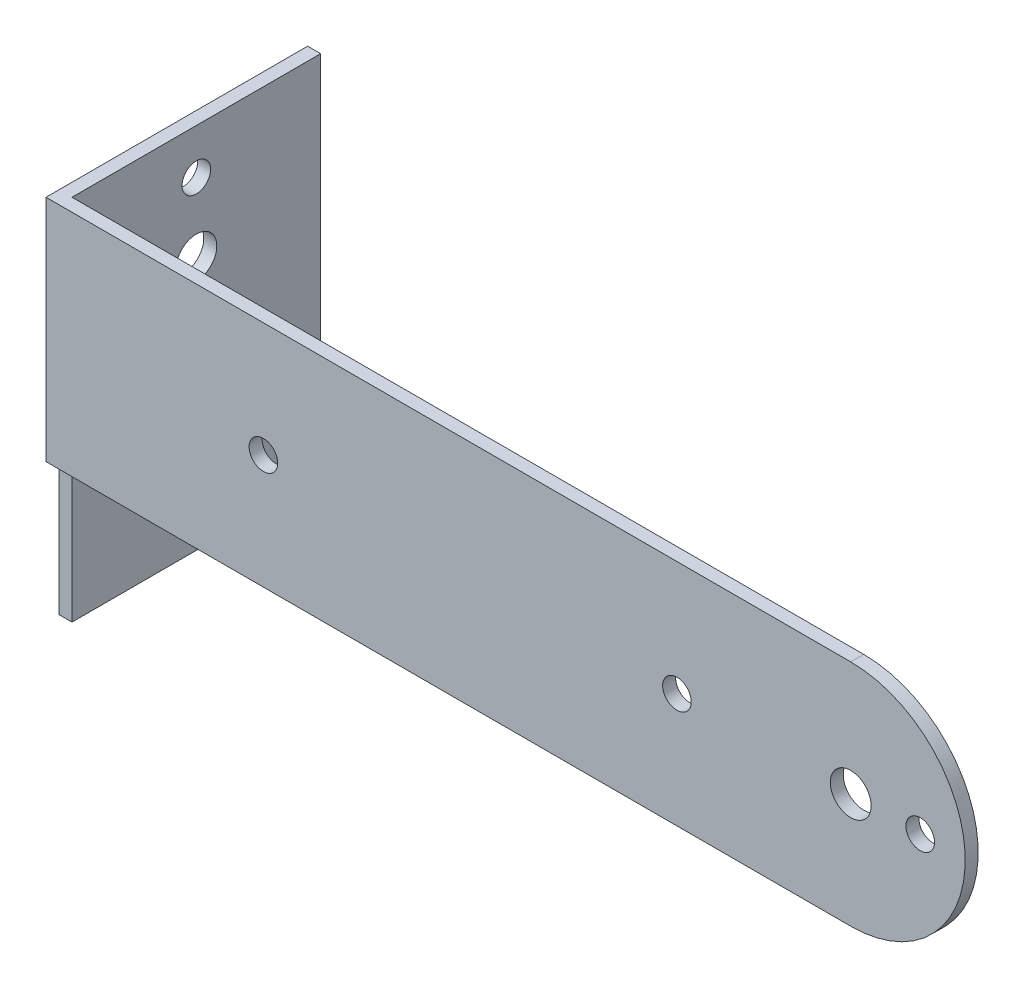
from build123d import *

# Parameters (mm, degrees)
BOSS_EXTRUDE1_DEPTH = 1.59
SKETCH2_W           = 1.59
SKETCH2_H           = 45
BOSS_EXTRUDE2_DEPTH = 30.41
SKETCH3_R           = 1.75
SKETCH3_R_2         = 2.5
CUT_EXTRUDE1_DEPTH  = 108.565311323
SKETCH4_R           = 2.5
SKETCH4_R_2         = 1.75
CUT_EXTRUDE2_DEPTH  = 30.41


with BuildPart() as part:
    # Sketch1 → Boss-Extrude1 (new body)
    with BuildSketch(Plane.XY):
        with BuildLine():
            Line((0, 14), (-98.41, 14))
            Line((-98.41, 14), (-98.41, -14))
            Line((-98.41, -14), (0, -14))
            ThreePointArc((0, -14), (14, 0), (0, 14))
        make_face()
    extrude(amount=BOSS_EXTRUDE1_DEPTH)

    # Sketch2 → Boss-Extrude2 (add)
    with BuildSketch(Plane(origin=(0, 0, 0), x_dir=(-1, 0, 0), z_dir=(0, 0, -1))):
        with Locations((97.615, -8.5)):
            Rectangle(SKETCH2_W, SKETCH2_H)
    extrude(amount=BOSS_EXTRUDE2_DEPTH)

    # Sketch3 → Cut-Extrude1 (cut, through all)
    with BuildSketch(Plane(origin=(0, 0, 0), x_dir=(-1, 0, 0), z_dir=(0, 0, -1))):
        with Locations((71.82, 0)):
            Circle(SKETCH3_R)
        with Locations((-8.5, 0)):
            Circle(SKETCH3_R)
        Circle(SKETCH3_R_2)
        with Locations((21.25, 0)):
            Circle(SKETCH3_R)
    extrude(amount=-CUT_EXTRUDE1_DEPTH, mode=Mode.SUBTRACT)

    # Sketch4 → Cut-Extrude2 (cut)
    with BuildSketch(Plane.ZY.offset(98.41)):
        with Locations((-15.205, 0)):
            Circle(SKETCH4_R)
        with Locations((-15.205, 8.5)):
            Circle(SKETCH4_R_2)
        with Locations((-15.205, -21.25)):
            Circle(SKETCH4_R_2)
    extrude(amount=-CUT_EXTRUDE2_DEPTH, mode=Mode.SUBTRACT)


solid = part.part
